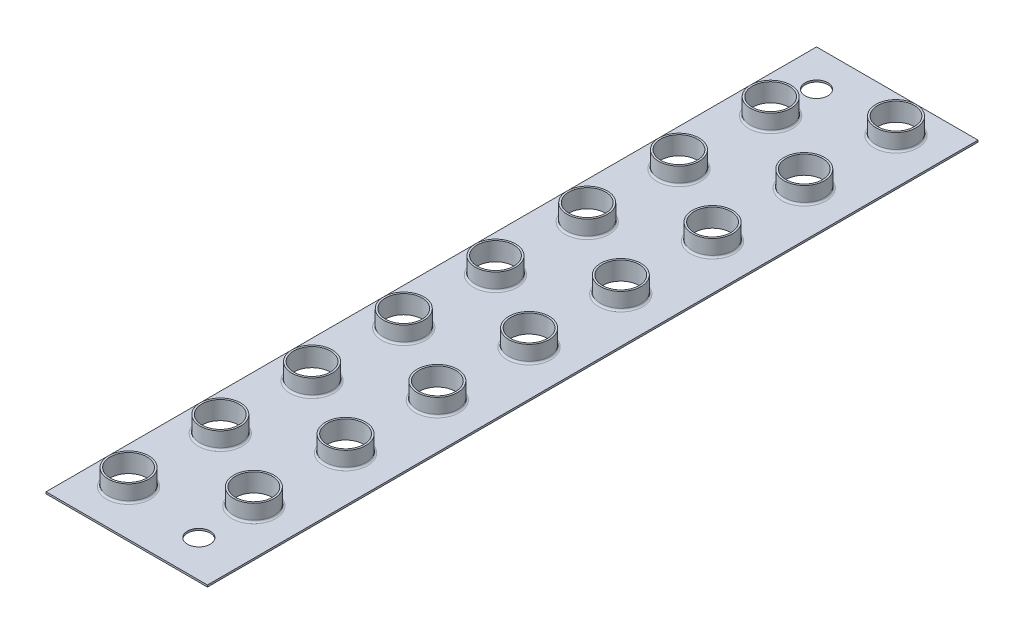
from build123d import *

# Parameters (mm, degrees)
SKETCH1_W           = 44
SKETCH1_H           = 210
BOSS_EXTRUDE1_DEPTH = 0.5
SKETCH2_R           = 5.5
SKETCH2_R_2         = 5
BOSS_EXTRUDE2_DEPTH = 4.5
FILLET1_R           = 0.5
SKETCH3_R           = 3.1
CUT_EXTRUDE1_DEPTH  = 4.5
CUT_EXTRUDE2_START  = -10
SKETCH2_2_R         = 5
CUT_EXTRUDE2_DEPTH  = 10
LPATTERN1_COUNT     = 8
LPATTERN1_PITCH     = 25


with BuildPart() as part:
    # Sketch1 → Boss-Extrude1 (new body)
    with BuildSketch(Plane(origin=(0, 0, 0), x_dir=(1, 0, 0), z_dir=(0, 1, 0))):
        with Locations((22, -105)):
            Rectangle(SKETCH1_W, SKETCH1_H)
    extrude(amount=BOSS_EXTRUDE1_DEPTH)

    # Sketch2 → Boss-Extrude2 (add)
    # profile 1 of 16: a face of its own
    with BuildSketch(Plane(origin=(0, 0.5, 0), x_dir=(1, 0, 0), z_dir=(0, 1, 0))):
        with Locations((31.650635095, -10)):
            Circle(SKETCH2_R)
        with Locations((31.650635095, -10)):
            Circle(SKETCH2_R_2, mode=Mode.SUBTRACT)
    # profile 2 of 16: a face of its own
    with BuildSketch(Plane(origin=(0, 0.5, 0), x_dir=(1, 0, 0), z_dir=(0, 1, 0))):
        with Locations((10, -22.5)):
            Circle(SKETCH2_R)
        with Locations((10, -22.5)):
            Circle(SKETCH2_R_2, mode=Mode.SUBTRACT)
    # profile 3 of 16: a face of its own
    with BuildSketch(Plane(origin=(0, 0.5, 0), x_dir=(1, 0, 0), z_dir=(0, 1, 0))):
        with Locations((10, -47.5)):
            Circle(SKETCH2_R)
        with Locations((10, -47.5)):
            Circle(SKETCH2_R_2, mode=Mode.SUBTRACT)
    # profile 4 of 16: a face of its own
    with BuildSketch(Plane(origin=(0, 0.5, 0), x_dir=(1, 0, 0), z_dir=(0, 1, 0))):
        with Locations((31.650635095, -35)):
            Circle(SKETCH2_R)
        with Locations((31.650635095, -35)):
            Circle(SKETCH2_R_2, mode=Mode.SUBTRACT)
    # profile 5 of 16: a face of its own
    with BuildSketch(Plane(origin=(0, 0.5, 0), x_dir=(1, 0, 0), z_dir=(0, 1, 0))):
        with Locations((10, -72.5)):
            Circle(SKETCH2_R)
        with Locations((10, -72.5)):
            Circle(SKETCH2_R_2, mode=Mode.SUBTRACT)
    # profile 6 of 16: a face of its own
    with BuildSketch(Plane(origin=(0, 0.5, 0), x_dir=(1, 0, 0), z_dir=(0, 1, 0))):
        with Locations((31.650635095, -60)):
            Circle(SKETCH2_R)
        with Locations((31.650635095, -60)):
            Circle(SKETCH2_R_2, mode=Mode.SUBTRACT)
    # profile 7 of 16: a face of its own
    with BuildSketch(Plane(origin=(0, 0.5, 0), x_dir=(1, 0, 0), z_dir=(0, 1, 0))):
        with Locations((10, -97.5)):
            Circle(SKETCH2_R)
        with Locations((10, -97.5)):
            Circle(SKETCH2_R_2, mode=Mode.SUBTRACT)
    # profile 8 of 16: a face of its own
    with BuildSketch(Plane(origin=(0, 0.5, 0), x_dir=(1, 0, 0), z_dir=(0, 1, 0))):
        with Locations((31.650635095, -85)):
            Circle(SKETCH2_R)
        with Locations((31.650635095, -85)):
            Circle(SKETCH2_R_2, mode=Mode.SUBTRACT)
    # profile 9 of 16: a face of its own
    with BuildSketch(Plane(origin=(0, 0.5, 0), x_dir=(1, 0, 0), z_dir=(0, 1, 0))):
        with Locations((10, -122.5)):
            Circle(SKETCH2_R)
        with Locations((10, -122.5)):
            Circle(SKETCH2_R_2, mode=Mode.SUBTRACT)
    # profile 10 of 16: a face of its own
    with BuildSketch(Plane(origin=(0, 0.5, 0), x_dir=(1, 0, 0), z_dir=(0, 1, 0))):
        with Locations((31.650635095, -110)):
            Circle(SKETCH2_R)
        with Locations((31.650635095, -110)):
            Circle(SKETCH2_R_2, mode=Mode.SUBTRACT)
    # profile 11 of 16: a face of its own
    with BuildSketch(Plane(origin=(0, 0.5, 0), x_dir=(1, 0, 0), z_dir=(0, 1, 0))):
        with Locations((10, -147.5)):
            Circle(SKETCH2_R)
        with Locations((10, -147.5)):
            Circle(SKETCH2_R_2, mode=Mode.SUBTRACT)
    # profile 12 of 16: a face of its own
    with BuildSketch(Plane(origin=(0, 0.5, 0), x_dir=(1, 0, 0), z_dir=(0, 1, 0))):
        with Locations((31.650635095, -135)):
            Circle(SKETCH2_R)
        with Locations((31.650635095, -135)):
            Circle(SKETCH2_R_2, mode=Mode.SUBTRACT)
    # profile 13 of 16: a face of its own
    with BuildSketch(Plane(origin=(0, 0.5, 0), x_dir=(1, 0, 0), z_dir=(0, 1, 0))):
        with Locations((10, -172.5)):
            Circle(SKETCH2_R)
        with Locations((10, -172.5)):
            Circle(SKETCH2_R_2, mode=Mode.SUBTRACT)
    # profile 14 of 16: a face of its own
    with BuildSketch(Plane(origin=(0, 0.5, 0), x_dir=(1, 0, 0), z_dir=(0, 1, 0))):
        with Locations((31.650635095, -160)):
            Circle(SKETCH2_R)
        with Locations((31.650635095, -160)):
            Circle(SKETCH2_R_2, mode=Mode.SUBTRACT)
    # profile 15 of 16: a face of its own
    with BuildSketch(Plane(origin=(0, 0.5, 0), x_dir=(1, 0, 0), z_dir=(0, 1, 0))):
        with Locations((10, -197.5)):
            Circle(SKETCH2_R)
        with Locations((10, -197.5)):
            Circle(SKETCH2_R_2, mode=Mode.SUBTRACT)
    # profile 16 of 16: a face of its own
    with BuildSketch(Plane(origin=(0, 0.5, 0), x_dir=(1, 0, 0), z_dir=(0, 1, 0))):
        with Locations((31.650635095, -185)):
            Circle(SKETCH2_R)
        with Locations((31.650635095, -185)):
            Circle(SKETCH2_R_2, mode=Mode.SUBTRACT)
    extrude(amount=BOSS_EXTRUDE2_DEPTH)

    # Fillet1
    fillet1_edges = [part.edges().sort_by_distance(p)[0] for p in [
        (4.5, 0.5, 22.5),
        (4.5, 0.5, 47.5),
        (4.5, 0.5, 72.5),
        (4.5, 0.5, 97.5),
        (4.5, 0.5, 122.5),
        (4.5, 0.5, 147.5),
        (4.5, 0.5, 172.5),
        (4.5, 0.5, 197.5),
        (26.150635095, 0.5, 185),
        (26.150635095, 0.5, 160),
        (26.150635095, 0.5, 135),
        (26.150635095, 0.5, 110),
        (26.150635095, 0.5, 85),
        (26.150635095, 0.5, 60),
        (26.150635095, 0.5, 35),
        (26.150635095, 0.5, 10),
    ]]
    fillet(fillet1_edges, radius=FILLET1_R)

    # Sketch3 → Cut-Extrude1 (cut)
    with BuildSketch(Plane(origin=(0, 0.5, 0), x_dir=(1, 0, 0), z_dir=(0, 1, 0))):
        with Locations((10, -10)):
            Circle(SKETCH3_R)
        with Locations((31.650635095, -200)):
            Circle(SKETCH3_R)
    extrude(amount=-CUT_EXTRUDE1_DEPTH, mode=Mode.SUBTRACT)

    # Sketch2<2> → Cut-Extrude2 (cut)
    with BuildSketch(Plane(origin=(0, 0.5, 0), x_dir=(1, 0, 0), z_dir=(0, 1, 0)).offset(CUT_EXTRUDE2_START)):
        with Locations((31.650635095, -10)):
            Circle(SKETCH2_2_R)
        with Locations((10, -22.5)):
            Circle(SKETCH2_2_R)
    cut_extrude2 = extrude(amount=CUT_EXTRUDE2_DEPTH, mode=Mode.SUBTRACT)

    # LPattern1: Cut-Extrude2 ×8
    with Locations(*[(0, 0, i * LPATTERN1_PITCH) for i in range(1, LPATTERN1_COUNT)]):
        add(cut_extrude2, mode=Mode.SUBTRACT)


solid = part.part
